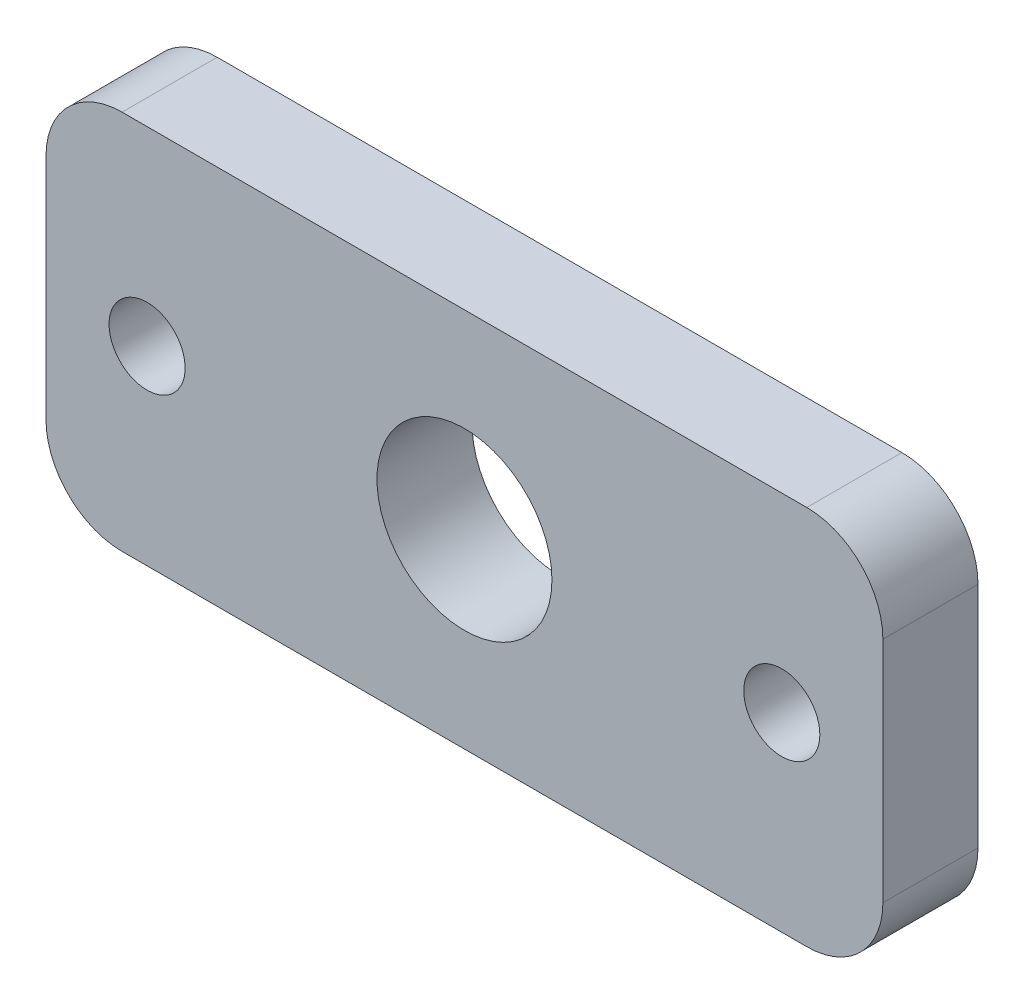
from build123d import *

# Parameters (mm, degrees)
SKETCH1_W              = 55.88
SKETCH1_H              = 25.4
SKETCH1_R              = 5.842
BOSS_EXTRUDE1_DEPTH    = 3.175
SKETCH2_R              = 2.54
CUT_EXTRUDE_4_40_DEPTH = 32.340965205
FILLET1_R              = 5.08


with BuildPart() as part:
    # Sketch1 → Boss-Extrude1 (new, symmetric)
    with BuildSketch(Plane.XY):
        Rectangle(SKETCH1_W, SKETCH1_H)
        Circle(SKETCH1_R, mode=Mode.SUBTRACT)
    extrude(amount=BOSS_EXTRUDE1_DEPTH, both=True)

    # Sketch2 → Cut-Extrude 4-40 (cut, through all)
    with BuildSketch(Plane.XY.offset(3.175)):
        with Locations((21.19, 0)):
            Circle(SKETCH2_R)
        with Locations(Location((-21.19, 0, 0), (0, 0, 180))):
            Circle(SKETCH2_R)
    extrude(amount=-CUT_EXTRUDE_4_40_DEPTH, mode=Mode.SUBTRACT)

    # Fillet1
    fillet1_edges = [part.edges().sort_by_distance(p)[0] for p in [
        (27.94, -12.7, 0),
        (-27.94, -12.7, 0),
        (-27.94, 12.7, 0),
        (27.94, 12.7, 0),
    ]]
    fillet(fillet1_edges, radius=FILLET1_R)


solid = part.part
